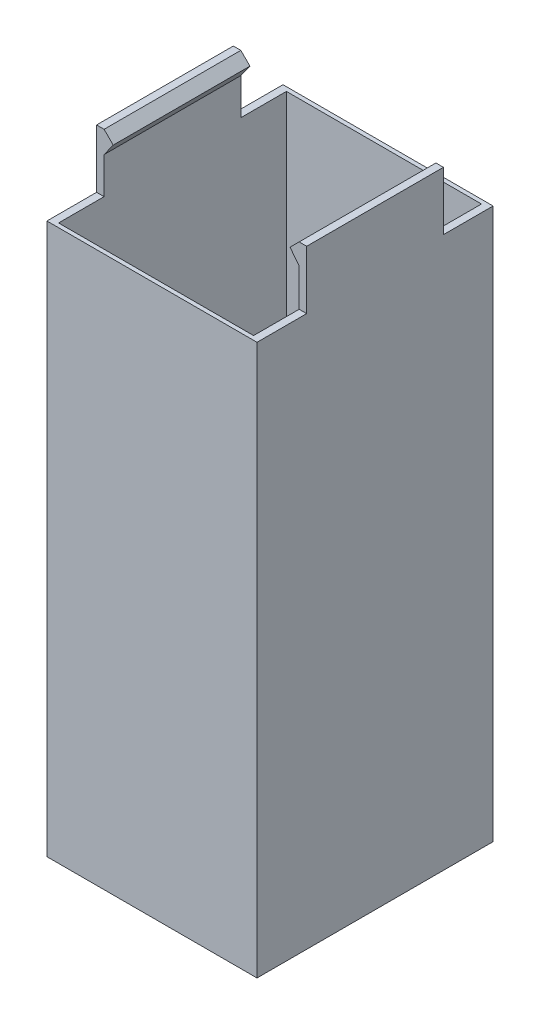
from build123d import *

# Parameters (mm, degrees)
SKETCH1_W           = 46.1
SKETCH1_H           = 51.8
SKETCH1_W_2         = 42.8
SKETCH1_H_2         = 50
BOSS_EXTRUDE1_DEPTH = 120
SKETCH2_W           = 1.65
SKETCH2_H           = 30
BOSS_EXTRUDE2_DEPTH = 12.8
BOSS_EXTRUDE5_DEPTH = 30
SKETCH6_W           = 46.1
SKETCH6_H           = 51.8
BOSS_EXTRUDE6_DEPTH = 0.8


with BuildPart() as part:
    # Sketch1 → Boss-Extrude1 (new body)
    with BuildSketch(Plane(origin=(0, 0, 0), x_dir=(1, 0, 0), z_dir=(0, 1, 0))):
        Rectangle(SKETCH1_W, SKETCH1_H)
        Rectangle(SKETCH1_W_2, SKETCH1_H_2, mode=Mode.SUBTRACT)
    extrude(amount=BOSS_EXTRUDE1_DEPTH)

    # Sketch2 → Boss-Extrude2 (add)
    with BuildSketch(Plane(origin=(0, 120, 0), x_dir=(1, 0, 0), z_dir=(0, 1, 0))):
        with Locations((22.225, 0)):
            Rectangle(SKETCH2_W, SKETCH2_H)
        with Locations((-22.225, 0)):
            Rectangle(SKETCH2_W, SKETCH2_H)
    extrude(amount=BOSS_EXTRUDE2_DEPTH)

    # Sketch5 → Boss-Extrude5 (add)
    with BuildSketch(Plane.XY.offset(15)):
        Polygon((-19.4, 130.8), (-21.4, 128), (-21.4, 132.8), align=None)
        Polygon((21.4, 128.2), (21.4, 132.8), (19.4, 130.8), align=None)
    extrude(amount=-BOSS_EXTRUDE5_DEPTH)

    # Sketch6 → Boss-Extrude6 (add)
    with BuildSketch(Plane.XZ):
        Rectangle(SKETCH6_W, SKETCH6_H)
    extrude(amount=BOSS_EXTRUDE6_DEPTH)


solid = part.part
